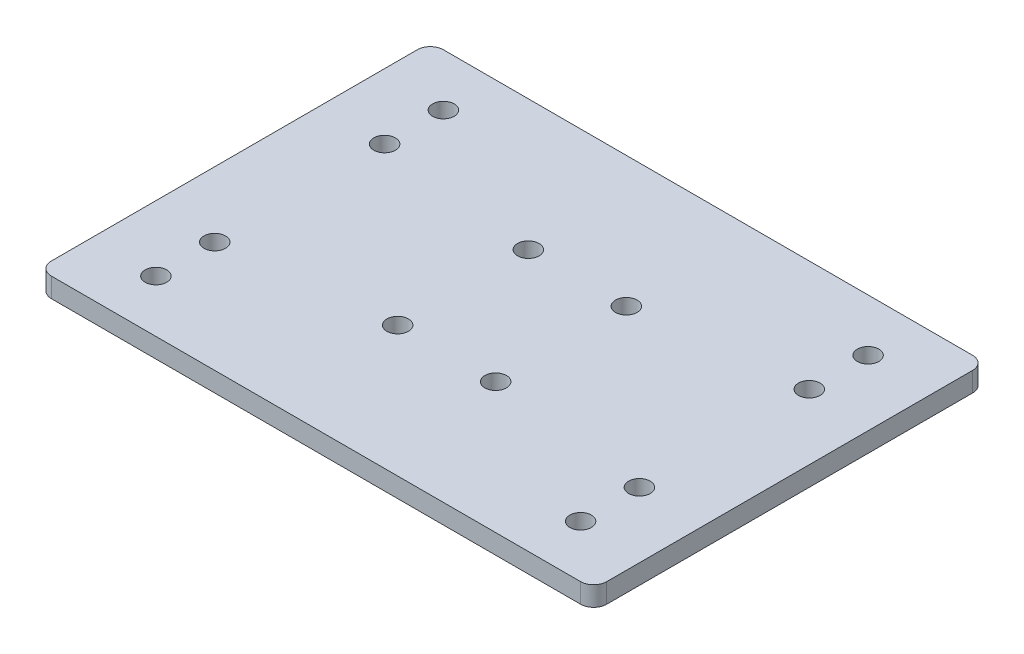
from build123d import *

# Parameters (mm, degrees)
SKETCH_1_W          = 85
SKETCH_1_H          = 60
EXTRUDE_1_DEPTH     = 3
SKETCH_2_R          = 1.65
CUT_EXTRUDE_1_DEPTH = 3
SKETCH_3_R          = 1.65
CUT_EXTRUDE_2_DEPTH = 100
FILLET_1_R          = 2


with BuildPart() as part:
    # 草图1 → 凸台-拉伸1 (new body)
    with BuildSketch(Plane(origin=(0, 0, 0), x_dir=(1, 0, 0), z_dir=(0, 1, 0))):
        Rectangle(SKETCH_1_W, SKETCH_1_H)
    extrude(amount=EXTRUDE_1_DEPTH)

    # 草图2 → 切除-拉伸1 (cut)
    with BuildSketch(Plane(origin=(0, 3, 0), x_dir=(1, 0, 0), z_dir=(0, 1, 0))):
        with Locations(Location((7.5, 10, 0), (0, 0, 270))):
            Circle(SKETCH_2_R)
        with Locations(Location((-7.5, 10, 0), (0, 0, 270))):
            Circle(SKETCH_2_R)
        with Locations(Location((-7.5, -10, 0), (0, 0, 270))):
            Circle(SKETCH_2_R)
        with Locations(Location((7.5, -10, 0), (0, 0, 270))):
            Circle(SKETCH_2_R)
    extrude(amount=-CUT_EXTRUDE_1_DEPTH, mode=Mode.SUBTRACT)

    # 草图3 → 切除-拉伸2 (cut)
    with BuildSketch(Plane(origin=(0, 3, 0), x_dir=(1, 0, 0), z_dir=(0, 1, 0))):
        with Locations(Location((32.5, 13, 0), (0, 0, 270))):
            Circle(SKETCH_3_R)
        with Locations(Location((32.5, 22, 0), (0, 0, 270))):
            Circle(SKETCH_3_R)
        with Locations(Location((32.5, -13, 0), (0, 0, 90))):
            Circle(SKETCH_3_R)
        with Locations(Location((32.5, -22, 0), (0, 0, 90))):
            Circle(SKETCH_3_R)
    cut_extrude_2 = extrude(amount=-CUT_EXTRUDE_2_DEPTH, mode=Mode.SUBTRACT)

    # 镜向1: 切除-拉伸2 across plane
    add(cut_extrude_2.mirror(Plane(origin=(0, 0, 0), x_dir=(0, 0, 1), z_dir=(1, 0, 0))), mode=Mode.SUBTRACT)

    # 圆角1
    fillet_1_edges = [part.edges().sort_by_distance(p)[0] for p in [
        (42.5, 1.5, 30),
        (-42.5, 1.5, 30),
        (-42.5, 1.5, -30),
        (42.5, 1.5, -30),
    ]]
    fillet(fillet_1_edges, radius=FILLET_1_R)


solid = part.part
